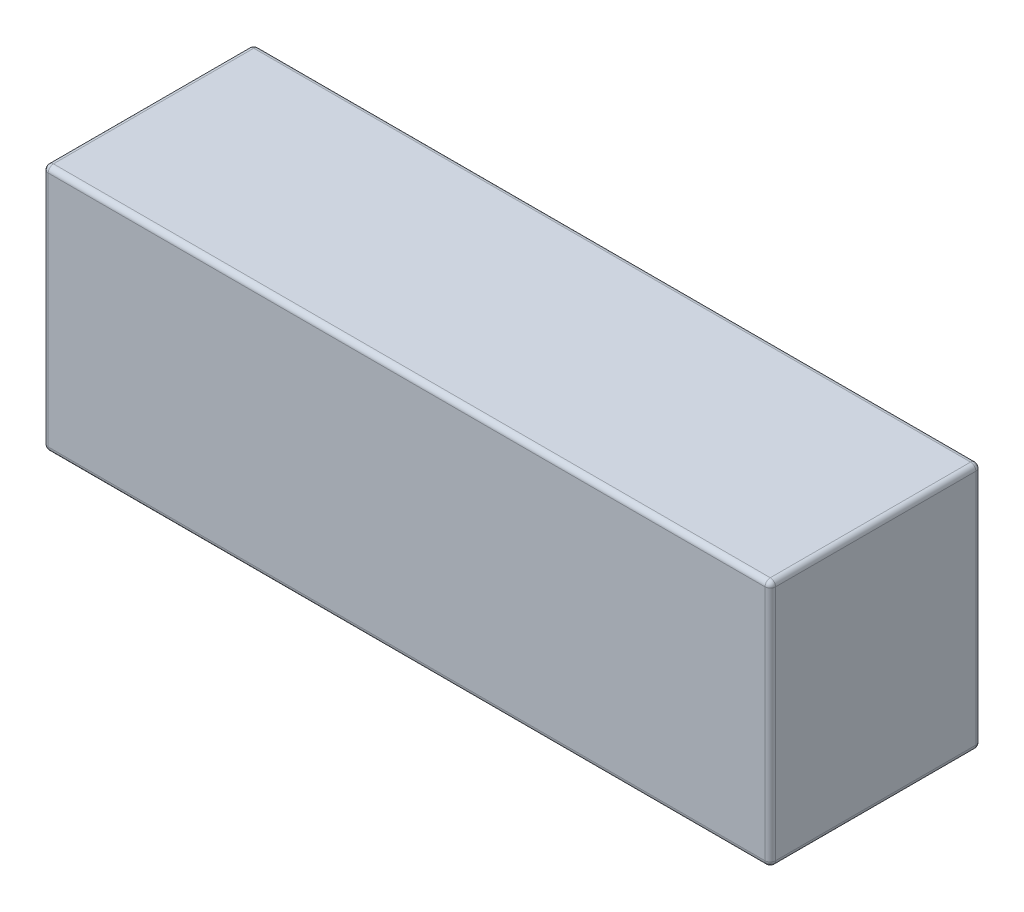
from build123d import *

# Parameters (mm, degrees)
SKETCH1_W           = 138
SKETCH1_H           = 47
BOSS_EXTRUDE1_DEPTH = 20
FILLET1_R           = 1


with BuildPart() as part:
    # Sketch1 → Boss-Extrude1 (new, symmetric)
    with BuildSketch(Plane.XY):
        Rectangle(SKETCH1_W, SKETCH1_H)
    extrude(amount=BOSS_EXTRUDE1_DEPTH, both=True)

    # Fillet1
    fillet1_edges = [part.edges().sort_by_distance(p)[0] for p in [
        (-69, 0, 20),
        (0, -23.5, 20),
        (69, 0, 20),
        (0, -23.5, -20),
        (-69, 0, -20),
        (0, 23.5, -20),
        (69, 0, -20),
        (69, -23.5, 0),
        (-69, -23.5, 0),
        (-69, 23.5, 0),
        (69, 23.5, 0),
        (0, 23.5, 20),
    ]]
    fillet(fillet1_edges, radius=FILLET1_R)


solid = part.part
